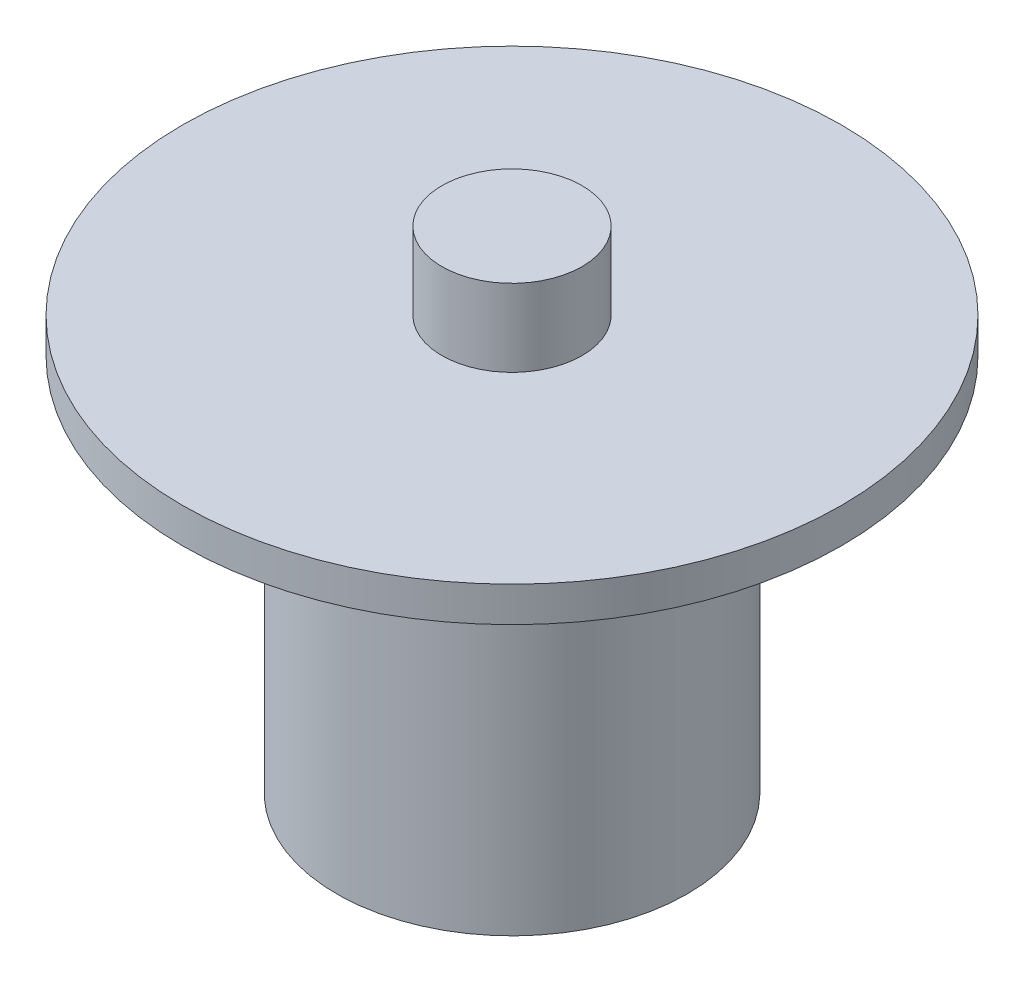
from build123d import *


with BuildPart() as part:
    # Sketch1 → Revolve1 (revolve)
    with BuildSketch(Plane.XY, mode=Mode.PRIVATE) as revolve1_sk:
        Polygon((0, -8.75), (0, 8.75), (-2.5, 8.75), (-2.5, 6), (-11.75, 6), (-11.75, 4.75), (-6.25, 4.75), (-6.25, -8.75), align=None)
    revolve(revolve1_sk.sketch.rotate(Axis((0, -8.75, 0), (0, 1, 0)), 180), axis=Axis((0, -8.75, 0), (0, 1, 0)))


solid = part.part
